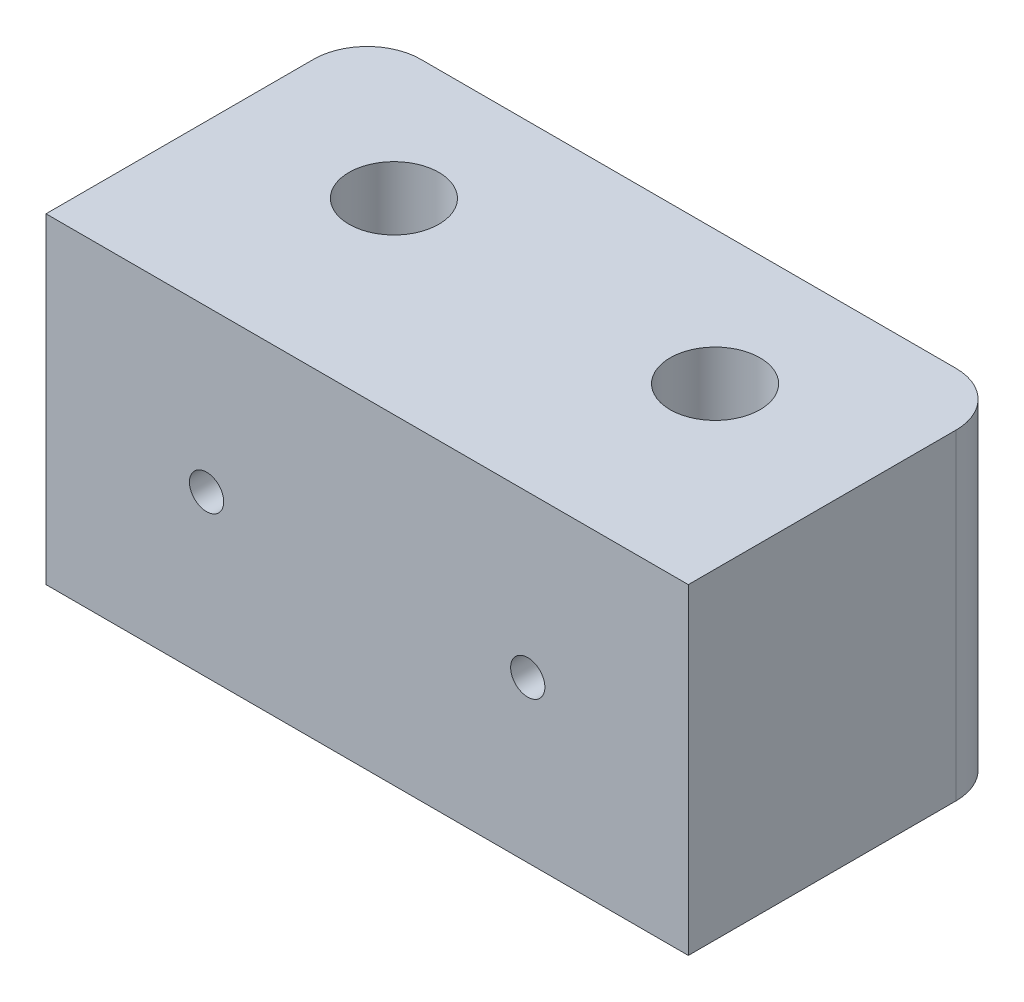
from build123d import *

# Parameters (mm, degrees)
SKETCH1_W             = 30
SKETCH1_H             = 15
BOSS_EXTRUDE1_DEPTH   = 15
FILLET1_R             = 2.5
M5_TAPPED_HOLE1_D     = 4.2
M5_TAPPED_HOLE1_DEPTH = 12.4
M5_TAPPED_HOLE1_TIP   = 1.2618073
M2_TAPPED_HOLE1_D     = 1.6
M2_TAPPED_HOLE1_DEPTH = 5
M2_TAPPED_HOLE1_TIP   = 0.480688495


with BuildPart() as part:
    # Sketch1 → Boss-Extrude1 (new body)
    with BuildSketch(Plane(origin=(0, 0, 0), x_dir=(1, 0, 0), z_dir=(0, 1, 0))):
        Rectangle(SKETCH1_W, SKETCH1_H)
    extrude(amount=BOSS_EXTRUDE1_DEPTH)

    # Fillet1
    fillet1_edges = [part.edges().sort_by_distance(p)[0] for p in [
        (-15, 7.5, -7.5),
        (15, 7.5, -7.5),
    ]]
    fillet(fillet1_edges, radius=FILLET1_R)

    # M5 Tapped Hole1
    with Locations(Plane(origin=(0, 15, 0), x_dir=(1, 0, 0), z_dir=(0, 1, 0))):
        with Locations((-7.5, 1.25), (7.5, 1.25)):
            Hole(M5_TAPPED_HOLE1_D / 2, depth=M5_TAPPED_HOLE1_DEPTH)
            with Locations((0, 0, -(M5_TAPPED_HOLE1_DEPTH + M5_TAPPED_HOLE1_TIP / 2))):  # 118° drill point
                Cone(0, M5_TAPPED_HOLE1_D / 2, M5_TAPPED_HOLE1_TIP, mode=Mode.SUBTRACT)

    # M2 Tapped Hole1
    with Locations(Plane.XY.offset(7.5)):
        with Locations((7.5, 7.5), (-7.5, 7.5)):
            Hole(M2_TAPPED_HOLE1_D / 2, depth=M2_TAPPED_HOLE1_DEPTH)
            with Locations((0, 0, -(M2_TAPPED_HOLE1_DEPTH + M2_TAPPED_HOLE1_TIP / 2))):  # 118° drill point
                Cone(0, M2_TAPPED_HOLE1_D / 2, M2_TAPPED_HOLE1_TIP, mode=Mode.SUBTRACT)


solid = part.part
